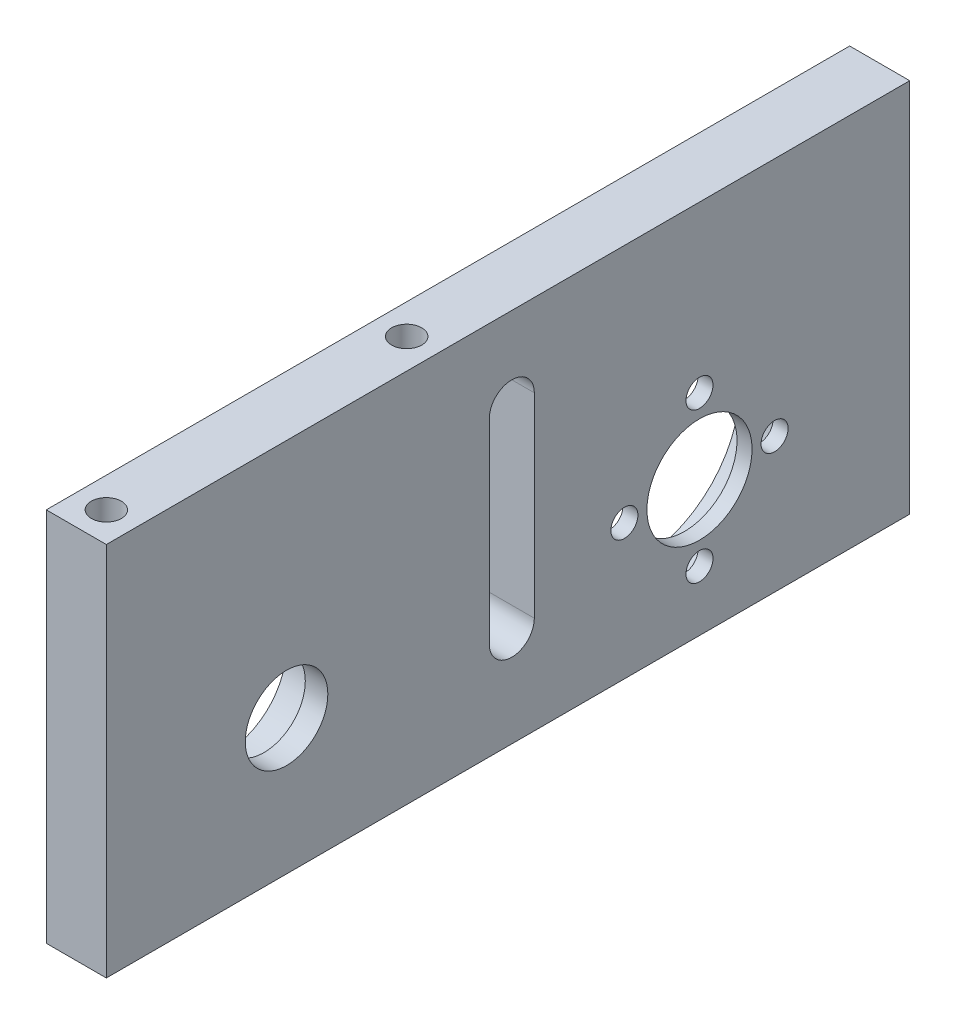
from build123d import *

# Parameters (mm, degrees)
ESQUISSE1_W             = 8
ESQUISSE1_H             = 107
BOSS_EXTRU_1_DEPTH      = 50
ESQUISSE4_R             = 1.8
ENL_V_MAT_EXTRU_2_DEPTH = 10
ESQUISSE4_3_R           = 13.4
ESQUISSE4_3_R_2         = 1.8
ESQUISSE4_3_R_3         = 7
ENL_V_MAT_EXTRU_3_DEPTH = 6
ESQUISSE4_4_R           = 7
ENL_V_MAT_EXTRU_4_DEPTH = 10
ENL_V_MAT_EXTRU_5_DEPTH = 10
ESQUISSE26_R            = 7.95
ENL_V_MAT_EXTRU_6_DEPTH = 10
ESQUISSE24_R            = 8.2
ESQUISSE24_R_2          = 5.5
BOSS_EXTRU_6_DEPTH      = 3
ESQUISSE29_R            = 2
ENL_V_MAT_EXTRU_7_DEPTH = 15
ENL_V_START             = -15
ESQUISSE30_R            = 2
ENL_V_MAT_EXTRU_8_DEPTH = 15


with BuildPart() as part:
    # Esquisse1 → Boss.-Extru.1 (new body)
    with BuildSketch(Plane(origin=(0, 0, 0), x_dir=(1, 0, 0), z_dir=(0, 1, 0))):
        with Locations((-15, 59.5)):
            Rectangle(ESQUISSE1_W, ESQUISSE1_H)
    extrude(amount=BOSS_EXTRU_1_DEPTH)

    # Esquisse4 → Enlèv. mat.-Extru.2 (cut)
    with BuildSketch(Plane.ZY.offset(19)):
        with Locations((-85, 8)):
            Circle(ESQUISSE4_R)
        with Locations((-75, 18)):
            Circle(ESQUISSE4_R)
        with Locations((-85, 28)):
            Circle(ESQUISSE4_R)
        with Locations((-95, 18)):
            Circle(ESQUISSE4_R)
    extrude(amount=-ENL_V_MAT_EXTRU_2_DEPTH, mode=Mode.SUBTRACT)

    # Esquisse4<3> → Enlèv. mat.-Extru.3 (cut)
    with BuildSketch(Plane.ZY.offset(19)):
        with Locations((-85, 18)):
            Circle(ESQUISSE4_3_R)
        with Locations((-85, 8)):
            Circle(ESQUISSE4_3_R_2, mode=Mode.SUBTRACT)
        with Locations((-95, 18)):
            Circle(ESQUISSE4_3_R_2, mode=Mode.SUBTRACT)
        with Locations((-85, 18)):
            Circle(ESQUISSE4_3_R_3, mode=Mode.SUBTRACT)
        with Locations((-75, 18)):
            Circle(ESQUISSE4_3_R_2, mode=Mode.SUBTRACT)
        with Locations((-85, 28)):
            Circle(ESQUISSE4_3_R_2, mode=Mode.SUBTRACT)
    extrude(amount=-ENL_V_MAT_EXTRU_3_DEPTH, mode=Mode.SUBTRACT)

    # Esquisse4<4> → Enlèv. mat.-Extru.4 (cut)
    with BuildSketch(Plane.ZY.offset(19)):
        with Locations((-85, 18)):
            Circle(ESQUISSE4_4_R)
    extrude(amount=-ENL_V_MAT_EXTRU_4_DEPTH, mode=Mode.SUBTRACT)

    # Esquisse9 → Enlèv. mat.-Extru.5 (cut)
    with BuildSketch(Plane.ZY.offset(19)):
        with BuildLine():
            ThreePointArc((-57, 39), (-60, 42), (-63, 39))
            Line((-63, 39), (-63, 13))
            ThreePointArc((-63, 13), (-60, 10), (-57, 13))
            Line((-57, 13), (-57, 39))
        make_face()
    extrude(amount=-ENL_V_MAT_EXTRU_5_DEPTH, mode=Mode.SUBTRACT)

    # Esquisse26 → Enlèv. mat.-Extru.6 (cut)
    with BuildSketch(Plane(origin=(-11, 0, 0), x_dir=(0, 0, -1), z_dir=(1, 0, 0))):
        with Locations((30, 18)):
            Circle(ESQUISSE26_R)
    extrude(amount=-ENL_V_MAT_EXTRU_6_DEPTH, mode=Mode.SUBTRACT)

    # Esquisse24 → Boss.-Extru.6 (add)
    with BuildSketch(Plane(origin=(-11, 0, 0), x_dir=(0, 0, -1), z_dir=(1, 0, 0))):
        with Locations((30, 18)):
            Circle(ESQUISSE24_R)
        with Locations((30, 18)):
            Circle(ESQUISSE24_R_2, mode=Mode.SUBTRACT)
    extrude(amount=-BOSS_EXTRU_6_DEPTH)

    # Esquisse29 → Enlèv. mat.-Extru.7 (cut)
    with BuildSketch(Plane.XZ):
        with Locations((-15, -109)):
            Circle(ESQUISSE29_R)
        with Locations((-15, -10)):
            Circle(ESQUISSE29_R)
        with Locations((-15, -50)):
            Circle(ESQUISSE29_R)
    extrude(amount=-ENL_V_MAT_EXTRU_7_DEPTH, mode=Mode.SUBTRACT)

    # Esquisse30 → Enlèv. mat.-Extru.8 (cut)
    with BuildSketch(Plane(origin=(0, 50, 0), x_dir=(1, 0, 0), z_dir=(0, 1, 0)).offset(ENL_V_START)):
        with Locations((-15, 10)):
            Circle(ESQUISSE30_R)
        with Locations((-15, 50)):
            Circle(ESQUISSE30_R)
    extrude(amount=ENL_V_MAT_EXTRU_8_DEPTH, mode=Mode.SUBTRACT)


solid = part.part
